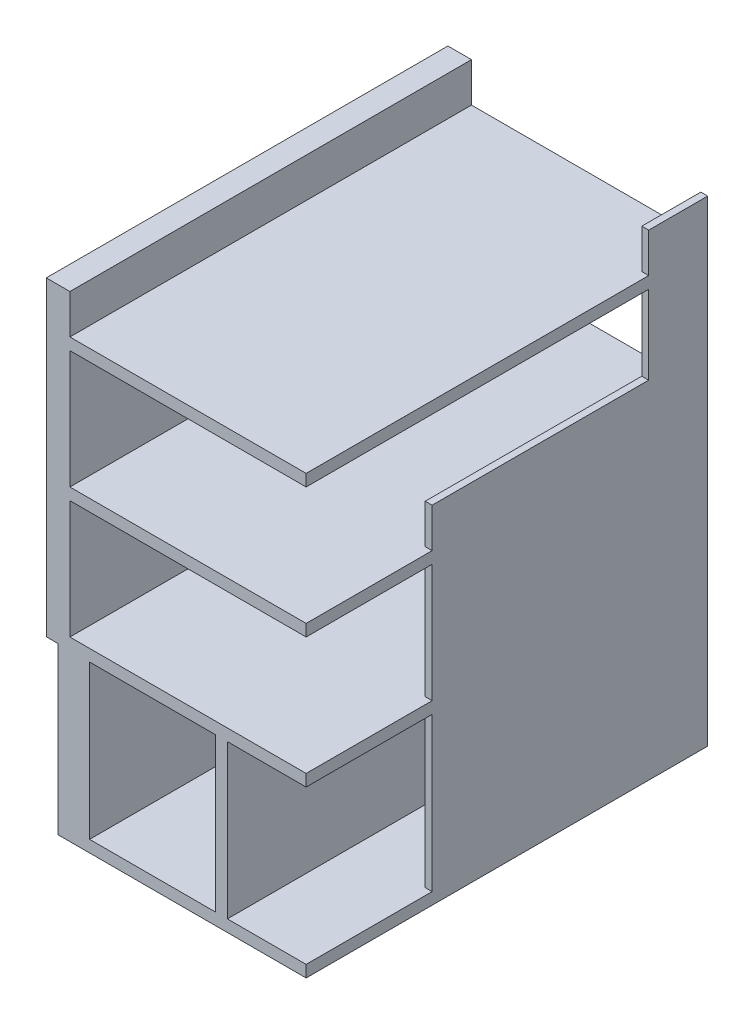
from build123d import *

# Parameters (mm, degrees)
BOSS_EXTRUDE1_DEPTH      = 51
BOSS_EXTRUDE1_DEPTH_BACK = 51
SKETCH2_W                = 3
SKETCH2_H                = 78.95
BOSS_EXTRUDE2_DEPTH      = 102
SKETCH3_W                = 5
SKETCH3_H                = 39
SKETCH3_W_2              = 3
BOSS_EXTRUDE3_DEPTH      = 102
SKETCH4_W                = 55
SKETCH4_H                = 39
BOSS_EXTRUDE4_DEPTH      = 1
BOSS_EXTRUDE5_DEPTH      = 1.75
SKETCH7_R                = 1.8
CUT_EXTRUDE1_DEPTH       = 6


with BuildPart() as part:
    # Sketch1 → Boss-Extrude1 (new, two sides: drawn at the far end of the back side and taken through both)
    with BuildSketch(Plane.XY.offset(-BOSS_EXTRUDE1_DEPTH_BACK)):
        Polygon((24.362132034, 0), (24.362132034, 121), (27.362132034, 121), (27.362132034, 111), (87.362132034, 111), (87.362132034, 108), (27.362132034, 108), (27.362132034, 78), (87.362132034, 78), (87.362132034, 75), (27.362132034, 75), (27.362132034, 45), (87.362132034, 45), (87.362132034, 42), (27.362132034, 42), (27.362132034, 3), (87.362132034, 3), (87.362132034, 0), align=None)
    extrude(amount=BOSS_EXTRUDE1_DEPTH + BOSS_EXTRUDE1_DEPTH_BACK)

    # Sketch2 → Boss-Extrude2 (add)
    with BuildSketch(Plane.XY.offset(51)):
        with Locations((22.862132034, 81.525)):
            Rectangle(SKETCH2_W, SKETCH2_H)
    extrude(amount=-BOSS_EXTRUDE2_DEPTH)

    # Sketch3 → Boss-Extrude3 (add)
    with BuildSketch(Plane.XY.offset(51)):
        with Locations((29.862132034, 22.5)):
            Rectangle(SKETCH3_W, SKETCH3_H)
        with Locations((65.862132034, 22.5)):
            Rectangle(SKETCH3_W_2, SKETCH3_H)
    extrude(amount=-BOSS_EXTRUDE3_DEPTH)

    # Sketch4 → Boss-Extrude4 (add)
    with BuildSketch(Plane(origin=(0, 0, -51), x_dir=(-1, 0, 0), z_dir=(0, 0, -1))):
        with Locations((-59.862132034, 22.5)):
            Rectangle(SKETCH4_W, SKETCH4_H)
    extrude(amount=-BOSS_EXTRUDE4_DEPTH)

    # Sketch5 → Boss-Extrude5 (add)
    with BuildSketch(Plane(origin=(87.362132034, 0, 0), x_dir=(0, 0, -1), z_dir=(1, 0, 0))):
        Polygon((36, 0), (36, 3), (-19, 3), (-19, 42), (-19, 75), (-19, 88), (36, 88), (36, 121), (51, 121), (51, 0), align=None)
    extrude(amount=-BOSS_EXTRUDE5_DEPTH)

    # Sketch7 → Cut-Extrude1 (cut)
    with BuildSketch(Plane.ZY.offset(-24.362132034)):
        with Locations((-29.362132034, 37)):
            Circle(SKETCH7_R)
        with Locations((-29.362132034, 10)):
            Circle(SKETCH7_R)
        with Locations((29.362132034, 10)):
            Circle(SKETCH7_R)
        with Locations((29.362132034, 37)):
            Circle(SKETCH7_R)
    extrude(amount=-CUT_EXTRUDE1_DEPTH, mode=Mode.SUBTRACT)


solid = part.part
